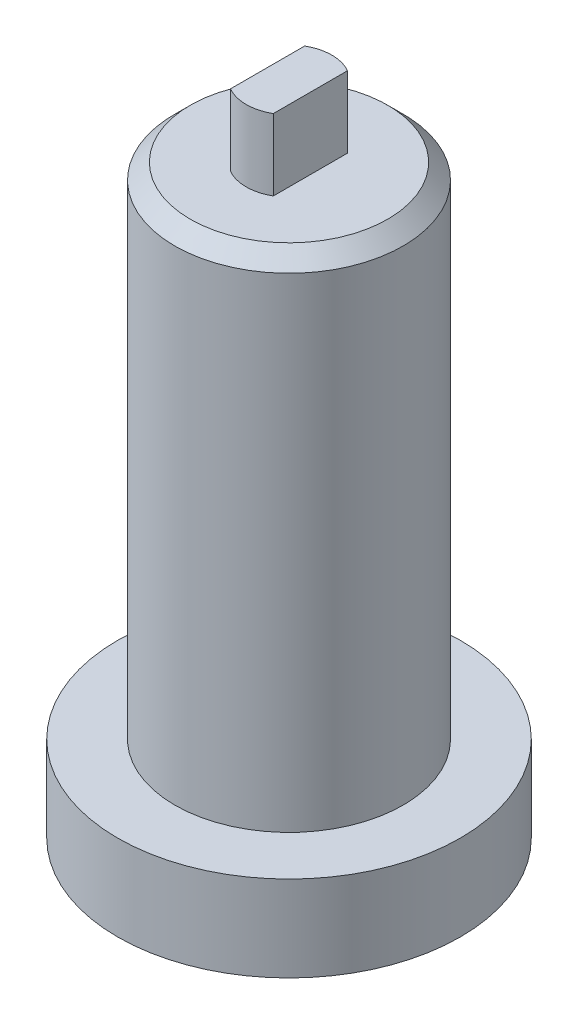
from build123d import *

# Parameters (mm, degrees)
CUT_EXTRUDE_1_DEPTH      = 16
CUT_EXTRUDE_1_DEPTH_BACK = 16


with BuildPart() as part:
    # 草图1 → 旋转1 (revolve)
    with BuildSketch(Plane.XY):
        Polygon((0, 46), (3, 46), (3, 41), (6.9175, 41), (8, 39.9175), (8, 6), (12, 6), (12, 0), (0, 0), align=None)
    revolve(axis=Axis((0, 0, 0), (0, 1, 0)))

    # 草图2 → 切除-拉伸1 (cut, two sides: drawn at the far end of the back side and taken through both)
    with BuildSketch(Plane.XY.offset(-CUT_EXTRUDE_1_DEPTH_BACK)):
        Polygon((-3, 41), (-1.5, 41), (-1.5, 46), (1.5, 46), (1.5, 41), (3, 41), (3, 49), (-3, 49), align=None)
    extrude(amount=CUT_EXTRUDE_1_DEPTH + CUT_EXTRUDE_1_DEPTH_BACK, mode=Mode.SUBTRACT)


solid = part.part
